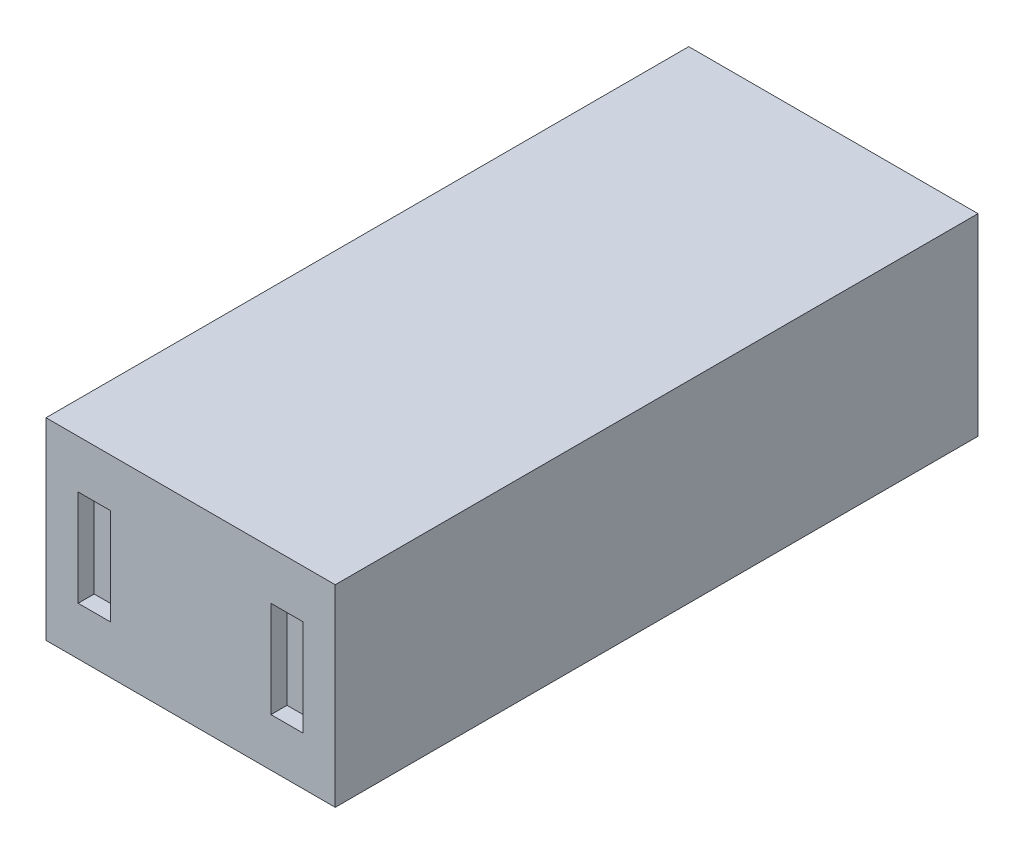
from build123d import *

# Parameters (mm, degrees)
SKETCH_1_W          = 90
SKETCH_1_H          = 60
EXTRUDE_1_DEPTH     = 100
SKETCH_2_W          = 10
SKETCH_2_H          = 30
CUT_EXTRUDE_1_DEPTH = 5


with BuildPart() as part:
    # Эскиз1 → Бобышка-Вытянуть1 (new, symmetric)
    with BuildSketch(Plane.XY):
        Rectangle(SKETCH_1_W, SKETCH_1_H)
    extrude(amount=EXTRUDE_1_DEPTH, both=True)

    # Эскиз2 → Вырез-Вытянуть1 (cut)
    with BuildSketch(Plane.XY.offset(100)):
        with Locations((-30, 0)):
            Rectangle(SKETCH_2_W, SKETCH_2_H)
        with Locations((30, 0)):
            Rectangle(SKETCH_2_W, SKETCH_2_H)
    extrude(amount=-CUT_EXTRUDE_1_DEPTH, mode=Mode.SUBTRACT)


solid = part.part
